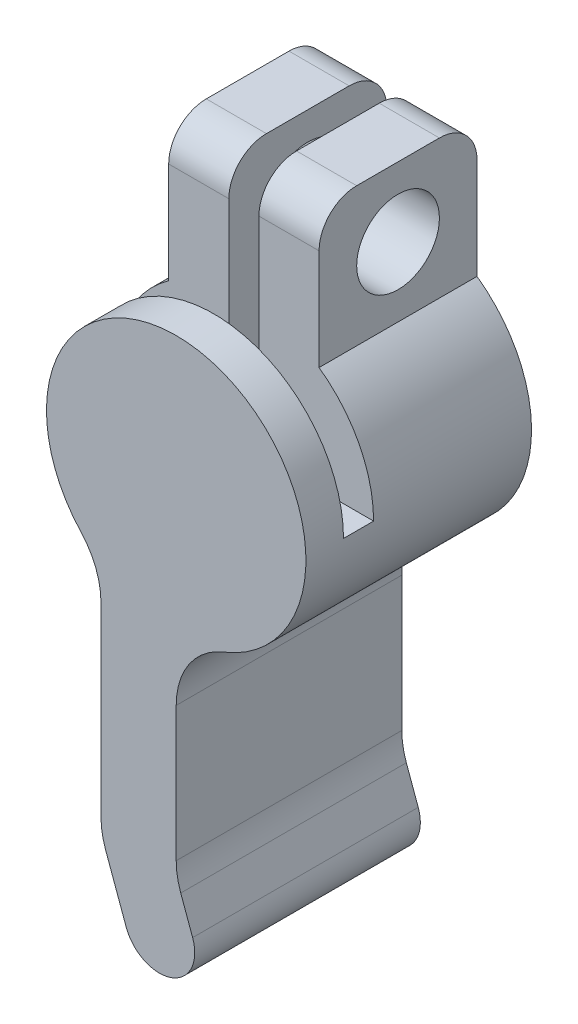
from build123d import *

# Parameters (mm, degrees)
BOSS_EXTRUDE1_DEPTH = 4.2
SKETCH2_R           = 1.1
CUT_EXTRUDE1_DEPTH  = 14.367834606
FILLET1_R           = 1
BOSS_EXTRUDE2_DEPTH = 0.8
BOSS_EXTRUDE3_DEPTH = 1
FILLET2_R           = 2


with BuildPart() as part:
    # Sketch1 → Boss-Extrude1 (new body)
    with BuildSketch(Plane.XY):
        with BuildLine():
            Line((0, -9), (0, -3.45))
            ThreePointArc((0, -3.45), (3.286405942, -1.049779017), (2, 2.811138559))
            Line((2, 2.811138559), (2, 6.5))
            Line((2, 6.5), (0.4, 6.5))
            Line((0.4, 6.5), (0.4, 1.393735986))
            ThreePointArc((0.4, 1.393735986), (0, -1.45), (-0.4, 1.393735986))
            Line((-0.4, 1.393735986), (-0.4, 6.5))
            Line((-0.4, 6.5), (-2, 6.5))
            Line((-2, 6.5), (-2, 2.811138559))
            ThreePointArc((-2, 2.811138559), (-3.45, 0), (-2, -2.811138559))
            Line((-2, -2.811138559), (-2, -9))
            Line((-2, -9), (-1.329280162, -10.84278761))
            ThreePointArc((-1.329280162, -10.84278761), (-0.124864136, -11.404416026), (0.436764281, -10.2))
            Line((0.436764281, -10.2), (0, -9))
        make_face()
    extrude(amount=BOSS_EXTRUDE1_DEPTH)

    # Sketch2 → Cut-Extrude1 (cut, through all)
    with BuildSketch(Plane.ZY.offset(2)):
        with Locations(Location((2.1, 4.65556928, 0), (0, 0, 270))):
            Circle(SKETCH2_R)
    extrude(amount=-CUT_EXTRUDE1_DEPTH, mode=Mode.SUBTRACT)

    # Fillet1
    fillet1_edges = [part.edges().sort_by_distance(p)[0] for p in [
        (-1.2, 6.5, 0),
        (1.2, 6.5, 0),
        (1.2, 6.5, 4.2),
        (-1.2, 6.5, 4.2),
    ]]
    fillet(fillet1_edges, radius=FILLET1_R)

    # Sketch3 → Boss-Extrude2 (add)
    with BuildSketch(Plane.XY.offset(4.2)):
        with BuildLine():
            Line((-1.45, 0), (-3.45, 0))
            ThreePointArc((-3.45, 0), (-3.066145789, -1.581534065), (-2, -2.811138559))
            Line((-2, -2.811138559), (-2, -9))
            Line((-2, -9), (-1.329280162, -10.84278761))
            ThreePointArc((-1.329280162, -10.84278761), (-0.124864136, -11.404416026), (0.436764281, -10.2))
            Line((0.436764281, -10.2), (0, -9))
            Line((0, -9), (0, -3.45))
            ThreePointArc((0, -3.45), (2.439518395, -2.439518395), (3.45, 0))
            Line((3.45, 0), (1.45, 0))
            ThreePointArc((1.45, 0), (0, -1.45), (-1.45, 0))
        make_face()
    extrude(amount=BOSS_EXTRUDE2_DEPTH)

    # Sketch4 → Boss-Extrude3 (add)
    with BuildSketch(Plane.XY.offset(5)):
        with BuildLine():
            ThreePointArc((1.45, 0), (1.158123482, 0.872496418), (0.4, 1.393735986))
            ThreePointArc((0.4, 1.393735986), (-0.872496418, 1.158123482), (-1.45, 0))
            ThreePointArc((-1.45, 0), (0, -1.45), (1.45, 0))
        make_face()
        with BuildLine():
            ThreePointArc((3.45, 0), (3.066145789, 1.581534065), (2, 2.811138559))
            ThreePointArc((2, 2.811138559), (-1.581534065, 3.066145789), (-3.45, 0))
            Line((-3.45, 0), (-1.45, 0))
            ThreePointArc((-1.45, 0), (-0.872496418, 1.158123482), (0.4, 1.393735986))
            ThreePointArc((0.4, 1.393735986), (1.158123482, 0.872496418), (1.45, 0))
            Line((1.45, 0), (3.45, 0))
        make_face()
        with BuildLine():
            ThreePointArc((0, -3.45), (2.439518395, -2.439518395), (3.45, 0))
            Line((3.45, 0), (1.45, 0))
            ThreePointArc((1.45, 0), (0, -1.45), (-1.45, 0))
            Line((-1.45, 0), (-3.45, 0))
            ThreePointArc((-3.45, 0), (-3.066145789, -1.581534065), (-2, -2.811138559))
            Line((-2, -2.811138559), (-2, -9))
            Line((-2, -9), (-1.329280162, -10.84278761))
            ThreePointArc((-1.329280162, -10.84278761), (-0.124864136, -11.404416026), (0.436764281, -10.2))
            Line((0.436764281, -10.2), (0, -9))
            Line((0, -9), (0, -3.45))
        make_face()
    extrude(amount=BOSS_EXTRUDE3_DEPTH)

    # Fillet2
    fillet2_edges = [part.edges().sort_by_distance(p)[0] for p in [
        (0, -3.45, 3),
        (0, -9, 3),
        (-2, -9, 3),
        (-2, -2.811138559, 3),
    ]]
    fillet(fillet2_edges, radius=FILLET2_R)


solid = part.part
